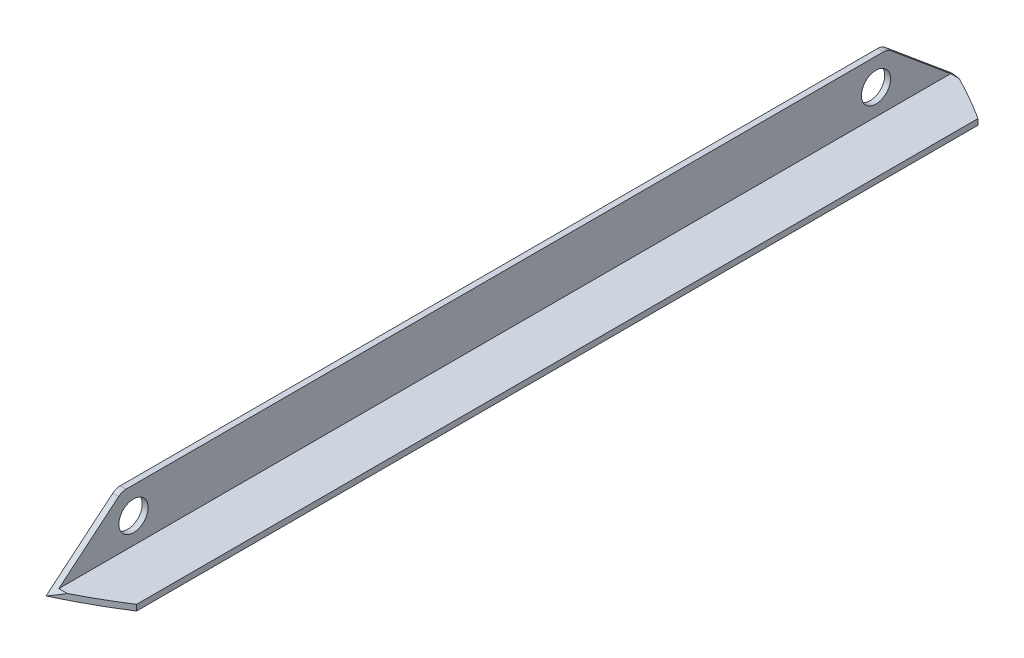
from build123d import *

# Parameters (mm, degrees)
BOSS_EXTRUDE1_DEPTH = 500
CUT_EXTRUDE1_DEPTH  = 70
CUT_EXTRUDE2_DEPTH  = 35
FILLET1_R           = 10
SKETCH4_R           = 12.5
CUT_EXTRUDE3_DEPTH  = 70


with BuildPart() as part:
    # Sketch1 → Boss-Extrude1 (new, symmetric)
    with BuildSketch(Plane.XY):
        Polygon((-14.024390244, 39.268292683), (-9.024390244, 39.268292683), (-9.024390244, -5.731707317), (35.975609756, -5.731707317), (35.975609756, -10.731707317), (-14.024390244, -10.731707317), align=None)
    extrude(amount=BOSS_EXTRUDE1_DEPTH, both=True)

    # Sketch2 → Cut-Extrude1 (cut)
    with BuildSketch(Plane(origin=(0, 39.268292683, 0), x_dir=(1, 0, 0), z_dir=(0, 1, 0))):
        with BuildLine():
            Line((-62.224317274, 529.897722978), (58.968835914, 529.897722978))
            Line((58.968835914, 529.897722978), (58.968835914, 344.739681267))
            ThreePointArc((58.968835914, 344.739681267), (0.874290628, 380.84092237), (-62.224317274, 407.238677616))
            Line((-62.224317274, 407.238677616), (-62.224317274, 529.897722978))
        make_face()
        with BuildLine():
            Line((75.729591142, -524.740567523), (-50.6207175, -524.740567523))
            Line((-50.6207175, -524.740567523), (-50.6207175, -403.255719892))
            ThreePointArc((-50.6207175, -403.255719892), (8.569896952, -376.772838636), (63.086584035, -341.661548879))
            Line((63.086584035, -341.661548879), (75.729591142, -341.661548879))
            Line((75.729591142, -341.661548879), (75.729591142, -524.740567523))
        make_face()
    extrude(amount=-CUT_EXTRUDE1_DEPTH, mode=Mode.SUBTRACT)

    # Sketch3 → Cut-Extrude2 (cut, symmetric)
    with BuildSketch(Plane(origin=(-9.024390244, 0, 0), x_dir=(0, 0, -1), z_dir=(1, 0, 0))):
        Polygon((388.162337174, -10.731707317), (328.162337174, 39.268292683), (388.162337174, 39.268292683), align=None)
    cut_extrude2 = extrude(amount=CUT_EXTRUDE2_DEPTH, both=True, mode=Mode.SUBTRACT)

    # Mirror1: Cut-Extrude2 across plane
    add(cut_extrude2.mirror(Plane.XY), mode=Mode.SUBTRACT)

    # Fillet1
    fillet1_edges = [part.edges().sort_by_distance(p)[0] for p in [
        (-11.524390244, 39.268292683, -328.162337174),
        (-11.524390244, 39.268292683, 328.162337174),
    ]]
    fillet(fillet1_edges, radius=FILLET1_R)

    # Sketch4 → Cut-Extrude3 (cut)
    with BuildSketch(Plane(origin=(-9.024390244, 0, 0), x_dir=(0, 0, -1), z_dir=(1, 0, 0))):
        with Locations(Location((318.162337174, 16.268292683, 0), (0, 0, 90))):
            Circle(SKETCH4_R)
        with Locations(Location((-318.162337174, 16.268292683, 0), (0, 0, 90))):
            Circle(SKETCH4_R)
    extrude(amount=-CUT_EXTRUDE3_DEPTH, mode=Mode.SUBTRACT)


solid = part.part
